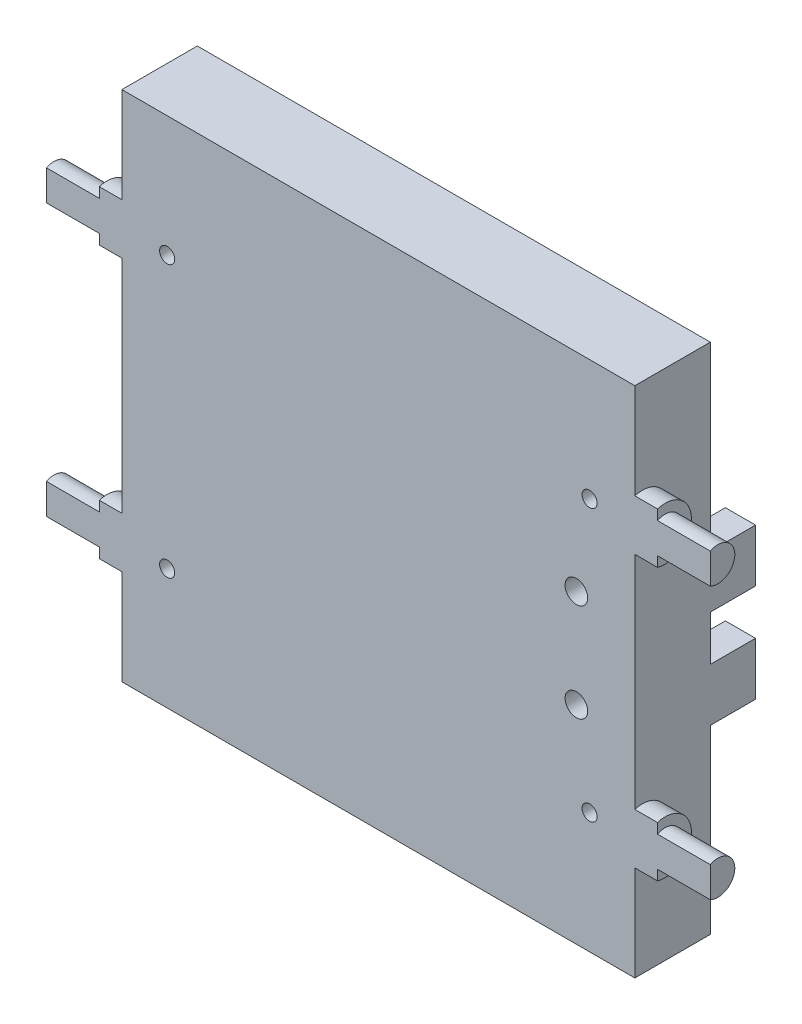
from build123d import *

# Parameters (mm, degrees)
SKETCH1_W           = 68
SKETCH1_H           = 68
BOSS_EXTRUDE1_DEPTH = 10
BOSS_EXTRUDE2_DEPTH = 3
BOSS_EXTRUDE3_DEPTH = 7
BOSS_EXTRUDE4_START = 3
BOSS_EXTRUDE4_DEPTH = 3
BOSS_EXTRUDE5_START = 7
BOSS_EXTRUDE5_DEPTH = 7
SKETCH6_W           = 42.5
SKETCH6_H           = 42.5
CUT_EXTRUDE1_DEPTH  = 3
SKETCH8_R           = 1.5
CUT_EXTRUDE2_DEPTH  = 5
SKETCH9_W           = 4
SKETCH9_H           = 7
BOSS_EXTRUDE6_DEPTH = 6
SKETCH10_R          = 1.5
CUT_EXTRUDE3_DEPTH  = 10
SKETCH11_R          = 1
CUT_EXTRUDE4_DEPTH  = 20
SKETCH13_W          = 7
SKETCH13_H          = 16
BOSS_EXTRUDE7_DEPTH = 12
CUT_EXTRUDE5_DEPTH  = 10
BOSS_EXTRUDE8_START = -7
BOSS_EXTRUDE8_DEPTH = 7


with BuildPart() as part:
    # Sketch1 → Boss-Extrude1 (new body)
    with BuildSketch(Plane.XY):
        with Locations((-34, -34)):
            Rectangle(SKETCH1_W, SKETCH1_H)
    extrude(amount=BOSS_EXTRUDE1_DEPTH)

    # Sketch2 → Boss-Extrude2 (add)
    with BuildSketch(Plane.ZY.offset(68)):
        with BuildLine():
            Line((10, -19.354101966), (10, -12.645898034))
            ThreePointArc((10, -12.645898034), (5.5, -16), (10, -19.354101966))
        make_face()
        with BuildLine():
            Line((10, -55.354101966), (10, -48.645898034))
            ThreePointArc((10, -48.645898034), (5.5, -52), (10, -55.354101966))
        make_face()
    extrude(amount=BOSS_EXTRUDE2_DEPTH)

    # Sketch3 → Boss-Extrude3 (add)
    with BuildSketch(Plane.ZY.offset(71)):
        with BuildLine():
            ThreePointArc((10, -49.984435563), (6.75, -52), (10, -54.015564437))
            Line((10, -54.015564437), (10, -49.984435563))
        make_face()
        with BuildLine():
            ThreePointArc((10, -13.984435563), (6.75, -16), (10, -18.015564437))
            Line((10, -18.015564437), (10, -13.984435563))
        make_face()
    extrude(amount=BOSS_EXTRUDE3_DEPTH)

    # Sketch4 → Boss-Extrude4 (add)
    with BuildSketch(Plane(origin=(0, 0, 0), x_dir=(0, 0, -1), z_dir=(1, 0, 0)).offset(BOSS_EXTRUDE4_START)):
        with BuildLine():
            ThreePointArc((-5.5, -16), (-6.908349934, -13.19375696), (-10, -12.645898034))
            Line((-10, -12.645898034), (-10, -19.354101966))
            ThreePointArc((-10, -19.354101966), (-6.908349934, -18.80624304), (-5.5, -16))
        make_face()
        with BuildLine():
            ThreePointArc((-5.5, -52), (-6.908349934, -49.19375696), (-10, -48.645898034))
            Line((-10, -48.645898034), (-10, -55.354101966))
            ThreePointArc((-10, -55.354101966), (-6.908349934, -54.80624304), (-5.5, -52))
        make_face()
    extrude(amount=-BOSS_EXTRUDE4_DEPTH)

    # Sketch5 → Boss-Extrude5 (add)
    with BuildSketch(Plane(origin=(3, 0, 0), x_dir=(0, 0, -1), z_dir=(1, 0, 0)).offset(BOSS_EXTRUDE5_START)):
        with BuildLine():
            ThreePointArc((-6.75, -16), (-7.814145877, -14.087867682), (-10, -13.984435563))
            Line((-10, -13.984435563), (-10, -18.015564437))
            ThreePointArc((-10, -18.015564437), (-7.814145877, -17.912132318), (-6.75, -16))
        make_face()
        with BuildLine():
            ThreePointArc((-6.75, -52), (-7.814145877, -50.087867682), (-10, -49.984435563))
            Line((-10, -49.984435563), (-10, -54.015564437))
            ThreePointArc((-10, -54.015564437), (-7.814145877, -53.912132318), (-6.75, -52))
        make_face()
    extrude(amount=-BOSS_EXTRUDE5_DEPTH)

    # Sketch6 → Cut-Extrude1 (cut)
    with BuildSketch(Plane(origin=(0, 0, 0), x_dir=(-1, 0, 0), z_dir=(0, 0, -1))):
        with Locations((34, -34)):
            Rectangle(SKETCH6_W, SKETCH6_H)
    extrude(amount=-CUT_EXTRUDE1_DEPTH, mode=Mode.SUBTRACT)

    # Sketch8 → Cut-Extrude2 (cut)
    with BuildSketch(Plane(origin=(0, 0, 0), x_dir=(-1, 0, 0), z_dir=(0, 0, -1))):
        with Locations((20.75, -7.75)):
            Circle(SKETCH8_R)
        with Locations(Location((47.25, -7.75, 0), (0, 0, 180))):
            Circle(SKETCH8_R)
        with Locations((47.25, -60.25)):
            Circle(SKETCH8_R)
        with Locations(Location((20.75, -60.25, 0), (0, 0, 180))):
            Circle(SKETCH8_R)
    extrude(amount=-CUT_EXTRUDE2_DEPTH, mode=Mode.SUBTRACT)

    # Sketch9 → Boss-Extrude6 (add)
    with BuildSketch(Plane(origin=(0, 0, 0), x_dir=(-1, 0, 0), z_dir=(0, 0, -1))):
        with Locations((2, -27.5)):
            Rectangle(SKETCH9_W, SKETCH9_H)
        with Locations((2, -40.5)):
            Rectangle(SKETCH9_W, SKETCH9_H)
    extrude(amount=BOSS_EXTRUDE6_DEPTH)

    # Sketch10 → Cut-Extrude3 (cut)
    with BuildSketch(Plane(origin=(0, 0, 0), x_dir=(-1, 0, 0), z_dir=(0, 0, -1))):
        with Locations((7.75, -27.5)):
            Circle(SKETCH10_R)
        with Locations(Location((7.75, -40.5, 0), (0, 0, 180))):
            Circle(SKETCH10_R)
    extrude(amount=-CUT_EXTRUDE3_DEPTH, mode=Mode.SUBTRACT)

    # Sketch11 → Cut-Extrude4 (cut)
    with BuildSketch(Plane.XY.offset(10)):
        with Locations((-62, -52)):
            Circle(SKETCH11_R)
        with Locations(Location((-62, -16, 0), (0, 0, 180))):
            Circle(SKETCH11_R)
        with Locations(Location((-6, -52, 0), (0, 0, 180))):
            Circle(SKETCH11_R)
        with Locations((-6, -16)):
            Circle(SKETCH11_R)
    extrude(amount=-CUT_EXTRUDE4_DEPTH, mode=Mode.SUBTRACT)

    # Sketch13 → Boss-Extrude7 (add)
    with BuildSketch(Plane(origin=(0, 0, 0), x_dir=(-1, 0, 0), z_dir=(0, 0, -1))):
        with Locations((62, -34)):
            Rectangle(SKETCH13_W, SKETCH13_H)
    extrude(amount=BOSS_EXTRUDE7_DEPTH)

    # Sketch15 → Cut-Extrude5 (cut)
    with BuildSketch(Plane.ZY.offset(65.5)):
        Polygon((-12, -32), (-3, -32), (-5, -30), (-12, -30), align=None)
        Polygon((-12, -38), (-12, -36), (-3, -36), (-5, -38), align=None)
    extrude(amount=-CUT_EXTRUDE5_DEPTH, mode=Mode.SUBTRACT)

    # Sketch16 → Boss-Extrude8 (add)
    with BuildSketch(Plane.ZY.offset(65.5).offset(BOSS_EXTRUDE8_START)):
        Polygon((0, -26), (-12, -26), (0, -21), align=None)
        Polygon((-12, -42), (0, -47), (0, -42), align=None)
    extrude(amount=BOSS_EXTRUDE8_DEPTH)


solid = part.part
